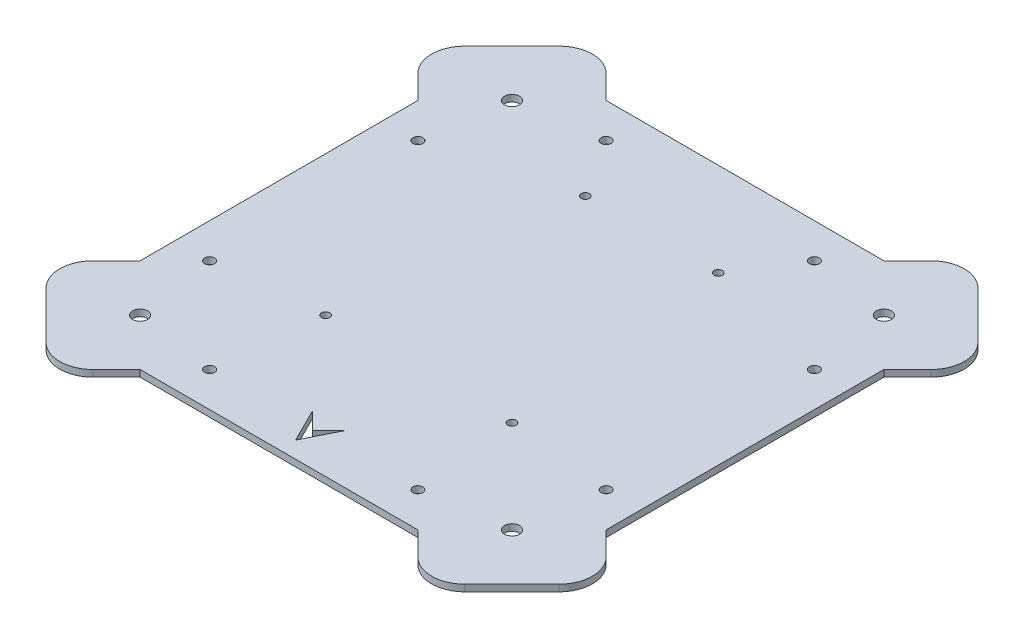
from build123d import *

# Parameters (mm, degrees)
SKETCH1_W           = 140
SKETCH1_H           = 140
BOSS_EXTRUDE1_DEPTH = 2
BOSS_EXTRUDE3_DEPTH = 2
FILLET1_R           = 10
SKETCH4_R           = 1.5
CUT_EXTRUDE2_DEPTH  = 2
SKETCH5_R           = 2.25
CUT_EXTRUDE3_DEPTH  = 10
SKETCH6_R           = 1.25
CUT_EXTRUDE4_DEPTH  = 15
CUT_EXTRUDE5_DEPTH  = 2


with BuildPart() as part:
    # Sketch1 → Boss-Extrude1 (new body)
    with BuildSketch(Plane(origin=(0, 0, 0), x_dir=(1, 0, 0), z_dir=(0, 1, 0))):
        with Locations((70, 70)):
            Rectangle(SKETCH1_W, SKETCH1_H)
    extrude(amount=BOSS_EXTRUDE1_DEPTH)

    # Sketch2 → Boss-Extrude3 (add)
    with BuildSketch(Plane(origin=(0, 2, 0), x_dir=(1, 0, 0), z_dir=(0, 1, 0))):
        Polygon((111.715728753, 140), (140, 111.715728753), (154.142135624, 125.857864376), (125.857864376, 154.142135624), align=None)
        Polygon((0, 111.715728753), (-14.142135624, 125.857864376), (14.142135624, 154.142135624), (28.284271247, 140), align=None)
        Polygon((28.284271247, 0), (0, 28.284271247), (-14.142135624, 14.142135624), (14.142135624, -14.142135624), align=None)
        Polygon((140, 28.284271247), (154.142135624, 14.142135624), (125.857864376, -14.142135624), (111.715728753, 0), align=None)
    extrude(amount=-BOSS_EXTRUDE3_DEPTH)

    # Fillet1
    fillet1_edges = [part.edges().sort_by_distance(p)[0] for p in [
        (125.857864376, 1, -154.142135624),
        (154.142135624, 1, -125.857864376),
        (-14.142135624, 1, -125.857864376),
        (14.142135624, 1, -154.142135624),
        (14.142135624, 1, 14.142135624),
        (-14.142135624, 1, -14.142135624),
        (154.142135624, 1, -14.142135624),
        (125.857864376, 1, 14.142135624),
    ]]
    fillet(fillet1_edges, radius=FILLET1_R)

    # Sketch4 → Cut-Extrude2 (cut)
    with BuildSketch(Plane(origin=(0, 2, 0), x_dir=(1, 0, 0), z_dir=(0, 1, 0))):
        with Locations(Location((38.717631804, 10.433360556, 0), (0, 0, 270))):
            Circle(SKETCH4_R)
        with Locations(Location((10.433360556, 38.717631804, 0), (0, 0, 90))):
            Circle(SKETCH4_R)
        with Locations(Location((101.282368196, 10.433360556, 0), (0, 0, 90))):
            Circle(SKETCH4_R)
        with Locations(Location((129.566639444, 38.717631804, 0), (0, 0, 270))):
            Circle(SKETCH4_R)
        with Locations(Location((38.717631804, 129.566639444, 0), (0, 0, 90))):
            Circle(SKETCH4_R)
        with Locations(Location((10.433360556, 101.282368196, 0), (0, 0, 270))):
            Circle(SKETCH4_R)
        with Locations(Location((101.282368196, 129.566639444, 0), (0, 0, 270))):
            Circle(SKETCH4_R)
        with Locations(Location((129.566639444, 101.282368196, 0), (0, 0, 90))):
            Circle(SKETCH4_R)
    extrude(amount=-CUT_EXTRUDE2_DEPTH, mode=Mode.SUBTRACT)

    # Sketch5 → Cut-Extrude3 (cut)
    with BuildSketch(Plane(origin=(0, 2, 0), x_dir=(1, 0, 0), z_dir=(0, 1, 0))):
        with Locations(Location((14.142135624, 14.142135624, 0), (0, 0, 270))):
            Circle(SKETCH5_R)
        with Locations(Location((125.857864376, 14.142135624, 0), (0, 0, 90))):
            Circle(SKETCH5_R)
        with Locations(Location((14.142135624, 125.857864376, 0), (0, 0, 90))):
            Circle(SKETCH5_R)
        with Locations(Location((125.857864376, 125.857864376, 0), (0, 0, 270))):
            Circle(SKETCH5_R)
    extrude(amount=-CUT_EXTRUDE3_DEPTH, mode=Mode.SUBTRACT)

    # Sketch6 → Cut-Extrude4 (cut)
    with BuildSketch(Plane(origin=(0, 2, 0), x_dir=(1, 0, 0), z_dir=(0, 1, 0))):
        with Locations(Location((90, 111.999971357, 0), (0, 0, 270))):
            Circle(SKETCH6_R)
        with Locations(Location((98, 41.999971357, 0), (0, 0, 270))):
            Circle(SKETCH6_R)
        with Locations(Location((42, 41.999971357, 0), (0, 0, 90))):
            Circle(SKETCH6_R)
        with Locations(Location((50, 111.999971357, 0), (0, 0, 90))):
            Circle(SKETCH6_R)
    extrude(amount=-CUT_EXTRUDE4_DEPTH, mode=Mode.SUBTRACT)

    # Sketch7 → Cut-Extrude5 (cut)
    with BuildSketch(Plane(origin=(0, 2, 0), x_dir=(1, 0, 0), z_dir=(0, 1, 0))):
        Polygon((75, 15), (70, 5), (65, 15), (70, 10), align=None)
    extrude(amount=-CUT_EXTRUDE5_DEPTH, mode=Mode.SUBTRACT)


solid = part.part
